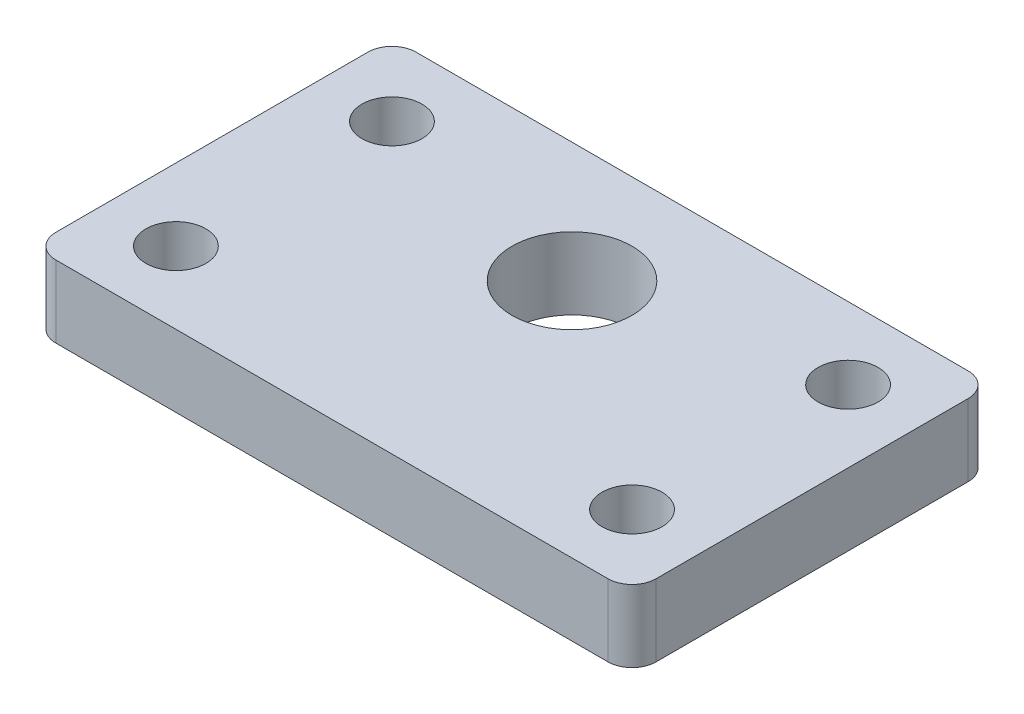
from build123d import *

# Parameters (mm, degrees)
Y_KSEKLIK_EKSTR_ZYON1_DEPTH = 30
IZIM2_R                     = 25
IZIM2_R_2                   = 12.5
KES_EKSTR_ZYON1_DEPTH       = 149.828760661


with BuildPart() as part:
    # Çizim1 → Yükseklik-Ekstrüzyon1 (new body)
    with BuildSketch(Plane(origin=(0, 0, 0), x_dir=(1, 0, 0), z_dir=(0, 1, 0))):
        with BuildLine():
            Line((-115, 75), (115, 75))
            ThreePointArc((115, 75), (122.071067812, 72.071067812), (125, 65))
            Line((125, 65), (125, -65))
            ThreePointArc((125, -65), (122.071067812, -72.071067812), (115, -75))
            Line((115, -75), (-115, -75))
            ThreePointArc((-115, -75), (-122.071067812, -72.071067812), (-125, -65))
            Line((-125, -65), (-125, 65))
            ThreePointArc((-125, 65), (-122.071067812, 72.071067812), (-115, 75))
        make_face()
    extrude(amount=Y_KSEKLIK_EKSTR_ZYON1_DEPTH)

    # Çizim2 → Kes-Ekstrüzyon1 (cut, through all)
    with BuildSketch(Plane(origin=(0, 30, 0), x_dir=(1, 0, 0), z_dir=(0, 1, 0))):
        with Locations(Location((0, 25, 0), (0, 0, 270))):
            Circle(IZIM2_R)
        with Locations(Location((-95, 45, 0), (0, 0, 270))):
            Circle(IZIM2_R_2)
        with Locations(Location((95, 45, 0), (0, 0, 270))):
            Circle(IZIM2_R_2)
        with Locations(Location((95, -45, 0), (0, 0, 270))):
            Circle(IZIM2_R_2)
        with Locations(Location((-95, -45, 0), (0, 0, 270))):
            Circle(IZIM2_R_2)
    extrude(amount=-KES_EKSTR_ZYON1_DEPTH, mode=Mode.SUBTRACT)


solid = part.part
